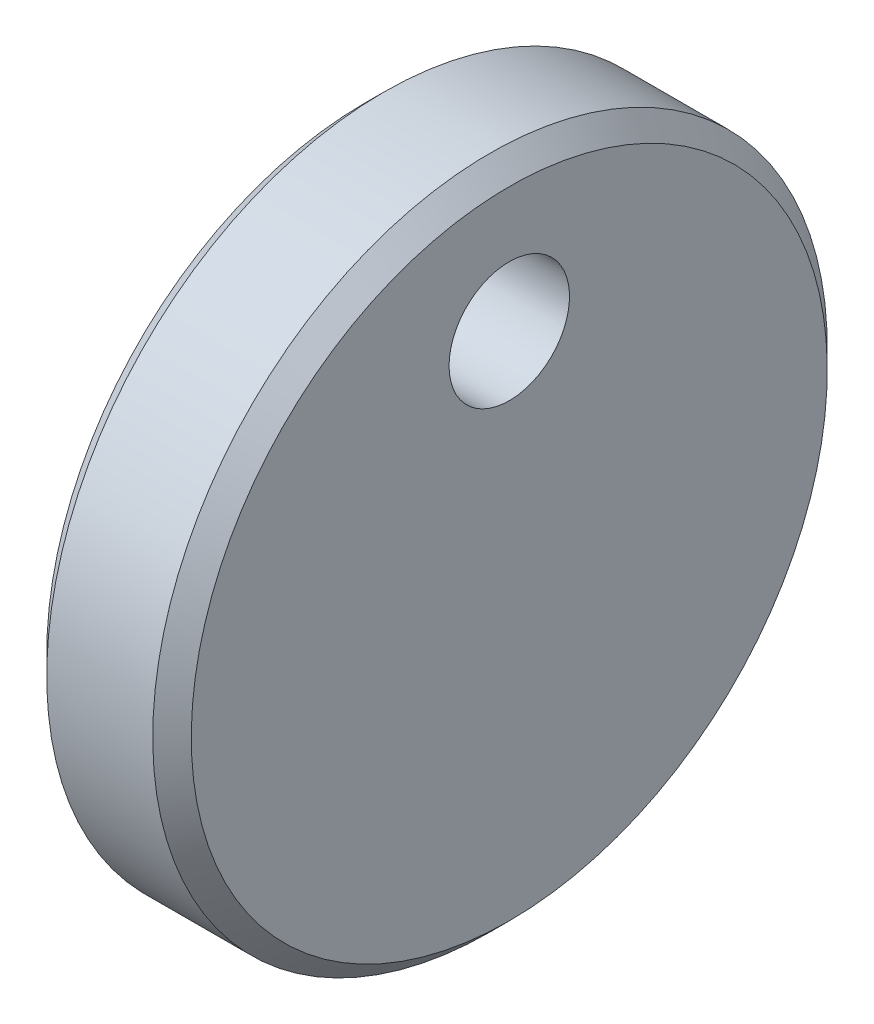
from build123d import *

# Parameters (mm, degrees)
SKETCH_2_W          = 3
SKETCH_2_H          = 7
SKETCH_3_R          = 1.25
CUT_EXTRUDE_1_DEPTH = 11.344080433
CHAMFER_1_SIZE      = 0.4


with BuildPart() as part:
    # Эскиз2 → Повернуть1 (revolve)
    with BuildSketch(Plane.XY, mode=Mode.PRIVATE) as revolve_1_sk:
        with Locations((-1.5, 3.5)):
            Rectangle(SKETCH_2_W, SKETCH_2_H)
    revolve(revolve_1_sk.sketch.rotate(Axis((-3, 0, 0), (1, 0, 0)), 180), axis=Axis((-3, 0, 0), (1, 0, 0)))

    # Эскиз3 → Вырез-Вытянуть1 (cut, through all)
    with BuildSketch(Plane.ZY.offset(3)):
        with Locations((0, 4)):
            Circle(SKETCH_3_R)
    extrude(amount=-CUT_EXTRUDE_1_DEPTH, mode=Mode.SUBTRACT)

    # Фаска1
    chamfer_1_edges = [part.edges().sort_by_distance(p)[0] for p in [
        (-3, 7, 0),
        (0, 7, 0),
    ]]
    chamfer(chamfer_1_edges, length=CHAMFER_1_SIZE)


solid = part.part
